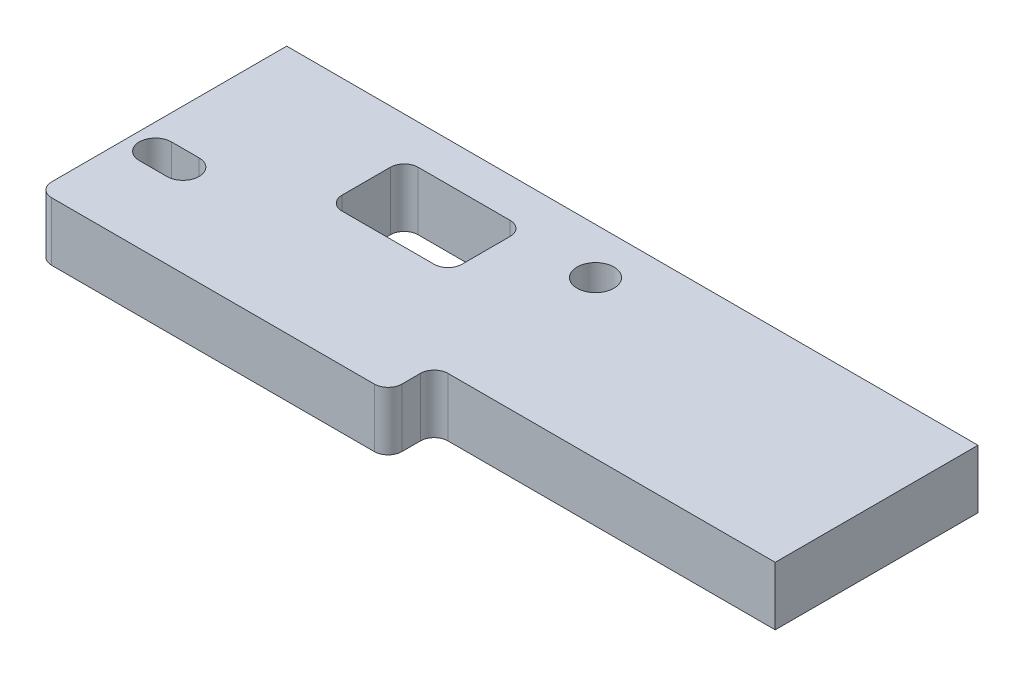
from build123d import *

# Parameters (mm, degrees)
SKETCH1_R           = 2
SKETCH1_R_2         = 3
SKETCH1_W           = 13
SKETCH1_H           = 8.25
BOSS_EXTRUDE1_DEPTH = 6.35
FILLET1_R           = 1.5
SKETCH2_W           = 82.327825706
SKETCH2_H           = 14.458254131
CUT_EXTRUDE1_DEPTH  = 51
SKETCH3_W           = 51.5
SKETCH3_H           = 6.35
BOSS_EXTRUDE2_DEPTH = 25
SKETCH4_W           = 84.929028447
SKETCH4_H           = 25.885902506
CUT_EXTRUDE2_DEPTH  = 90
SKETCH5_W           = 0.1
SKETCH5_H           = 6.35
CUT_EXTRUDE3_DEPTH  = 90
SKETCH6_W           = 81.24526446
SKETCH6_H           = 21.013173112
CUT_EXTRUDE4_DEPTH  = 71


with BuildPart() as part:
    # Sketch1 → Boss-Extrude1 (new body)
    with BuildSketch(Plane(origin=(0, 0, 0), x_dir=(1, 0, 0), z_dir=(0, 1, 0))):
        Polygon((38, 0), (38, 5), (58, 5), (58, 0), (96, 0), (96, 48.5), (89, 58.5), (89, 67.5), (62, 67.5), (62, 56.5), (34, 56.5), (34, 67.5), (7, 67.5), (7, 58.5), (0, 48.5), (0, 0), align=None)
        with Locations(Location((38.5, 40, 0), (0, 0, 270))):
            Circle(SKETCH1_R, mode=Mode.SUBTRACT)
        with Locations(Location((38.5, 22, 0), (0, 0, 270))):
            Circle(SKETCH1_R, mode=Mode.SUBTRACT)
        with Locations(Location((57.5, 22, 0), (0, 0, 90))):
            Circle(SKETCH1_R, mode=Mode.SUBTRACT)
        with Locations(Location((57.5, 40, 0), (0, 0, 90))):
            Circle(SKETCH1_R, mode=Mode.SUBTRACT)
        with Locations(Location((12.5, 61.75, 0), (0, 0, 270))):
            Circle(SKETCH1_R_2, mode=Mode.SUBTRACT)
        with Locations(Location((28, 61.75, 0), (0, 0, 270))):
            Circle(SKETCH1_R_2, mode=Mode.SUBTRACT)
        with Locations(Location((68, 61.75, 0), (0, 0, 90))):
            Circle(SKETCH1_R_2, mode=Mode.SUBTRACT)
        with Locations(Location((83.5, 61.75, 0), (0, 0, 90))):
            Circle(SKETCH1_R_2, mode=Mode.SUBTRACT)
        with Locations((72.5, 18.625)):
            Rectangle(SKETCH1_W, SKETCH1_H, mode=Mode.SUBTRACT)
        with Locations((23.5, 34.875)):
            Rectangle(SKETCH1_W, SKETCH1_H, mode=Mode.SUBTRACT)
        with Locations((23.5, 18.625)):
            Rectangle(SKETCH1_W, SKETCH1_H, mode=Mode.SUBTRACT)
        with Locations((72.5, 34.875)):
            Rectangle(SKETCH1_W, SKETCH1_H, mode=Mode.SUBTRACT)
        with BuildLine():
            Line((2.75, 11.75), (5.75, 11.75))
            ThreePointArc((5.75, 11.75), (7.5, 10), (5.75, 8.25))
            Line((5.75, 8.25), (2.75, 8.25))
            ThreePointArc((2.75, 8.25), (1, 10), (2.75, 11.75))
        make_face(mode=Mode.SUBTRACT)
        with BuildLine():
            Line((93.25, 8.25), (90.25, 8.25))
            ThreePointArc((90.25, 8.25), (88.5, 10), (90.25, 11.75))
            Line((90.25, 11.75), (93.25, 11.75))
            ThreePointArc((93.25, 11.75), (95, 10), (93.25, 8.25))
        make_face(mode=Mode.SUBTRACT)
        with BuildLine():
            Line((93.25, 45.5), (90.25, 45.5))
            ThreePointArc((90.25, 45.5), (88.5, 47.25), (90.25, 49))
            Line((90.25, 49), (93.25, 49))
            ThreePointArc((93.25, 49), (95, 47.25), (93.25, 45.5))
        make_face(mode=Mode.SUBTRACT)
        with BuildLine():
            Line((2.75, 49), (5.75, 49))
            ThreePointArc((5.75, 49), (7.5, 47.25), (5.75, 45.5))
            Line((5.75, 45.5), (2.75, 45.5))
            ThreePointArc((2.75, 45.5), (1, 47.25), (2.75, 49))
        make_face(mode=Mode.SUBTRACT)
    extrude(amount=BOSS_EXTRUDE1_DEPTH)

    # Fillet1
    fillet1_edges = [part.edges().sort_by_distance(p)[0] for p in [
        (0, 3.175, -48.5),
        (7, 3.175, -58.5),
        (7, 3.175, -67.5),
        (34, 3.175, -67.5),
        (34, 3.175, -56.5),
        (62, 3.175, -56.5),
        (62, 3.175, -67.5),
        (89, 3.175, -67.5),
        (89, 3.175, -58.5),
        (96, 3.175, -48.5),
        (96, 3.175, 0),
        (58, 3.175, 0),
        (58, 3.175, -5),
        (38, 3.175, -5),
        (38, 3.175, 0),
        (0, 3.175, 0),
        (17, 3.175, -39),
        (17, 3.175, -30.75),
        (30, 3.175, -30.75),
        (30, 3.175, -39),
        (17, 3.175, -22.75),
        (17, 3.175, -14.5),
        (30, 3.175, -14.5),
        (30, 3.175, -22.75),
        (79, 3.175, -14.5),
        (79, 3.175, -22.75),
        (66, 3.175, -22.75),
        (66, 3.175, -14.5),
        (79, 3.175, -30.75),
        (79, 3.175, -39),
        (66, 3.175, -39),
        (66, 3.175, -30.75),
    ]]
    fillet(fillet1_edges, radius=FILLET1_R)

    # Sketch2 → Cut-Extrude1 (cut)
    with BuildSketch(Plane(origin=(48, 0, 0), x_dir=(0, 0, -1), z_dir=(1, 0, 0))):
        with Locations((33.293792952, 1.315835649)):
            Rectangle(SKETCH2_W, SKETCH2_H)
    extrude(amount=CUT_EXTRUDE1_DEPTH, mode=Mode.SUBTRACT)

    # Sketch3 → Boss-Extrude2 (add)
    with BuildSketch(Plane(origin=(48, 0, 0), x_dir=(0, 0, -1), z_dir=(1, 0, 0))):
        with Locations((30.75, 3.175)):
            Rectangle(SKETCH3_W, SKETCH3_H)
    extrude(amount=BOSS_EXTRUDE2_DEPTH)

    # Mirror1: part across plane


with BuildPart() as part_1:
    add(part.part)
    add(part.part.mirror(Plane(origin=(73, 0, 0), x_dir=(0, 0, 1), z_dir=(1, 0, 0))))

    # Sketch4 → Cut-Extrude2 (cut)
    with BuildSketch(Plane(origin=(75, 0, 0), x_dir=(0, 0, -1), z_dir=(1, 0, 0))):
        with Locations((34.029781947, 1.13903014)):
            Rectangle(SKETCH4_W, SKETCH4_H)
    extrude(amount=CUT_EXTRUDE2_DEPTH, mode=Mode.SUBTRACT)

    # Sketch5 → Cut-Extrude3 (cut)
    with BuildSketch(Plane(origin=(75, 0, 0), x_dir=(0, 0, -1), z_dir=(1, 0, 0))):
        with Locations((27.05, 3.175)):
            Rectangle(SKETCH5_W, SKETCH5_H)
    extrude(amount=-CUT_EXTRUDE3_DEPTH, mode=Mode.SUBTRACT)


with BuildPart() as cut_extrude3_piece_1:
    # of the separate pieces the step leaves, piece 1, a body of its own (cut_extrude3_pieces)
    add(part_1.part.solids().sort_by_distance((0, 0, -48.027166654))[0])

    # Sketch6 → Cut-Extrude4 (cut)
    with BuildSketch(Plane(origin=(0, 0, -27), x_dir=(-1, 0, 0), z_dir=(0, 0, -1))):
        with Locations((-35.926138856, 1.728749219)):
            Rectangle(SKETCH6_W, SKETCH6_H)
    extrude(amount=CUT_EXTRUDE4_DEPTH, mode=Mode.SUBTRACT)


with BuildPart() as cut_extrude3_piece_2:
    # of the separate pieces the step leaves, piece 2, a body of its own (cut_extrude3_pieces)
    add(part_1.part.solids().sort_by_distance((38, 0, -1.5))[0])


solid = cut_extrude3_piece_2.part
